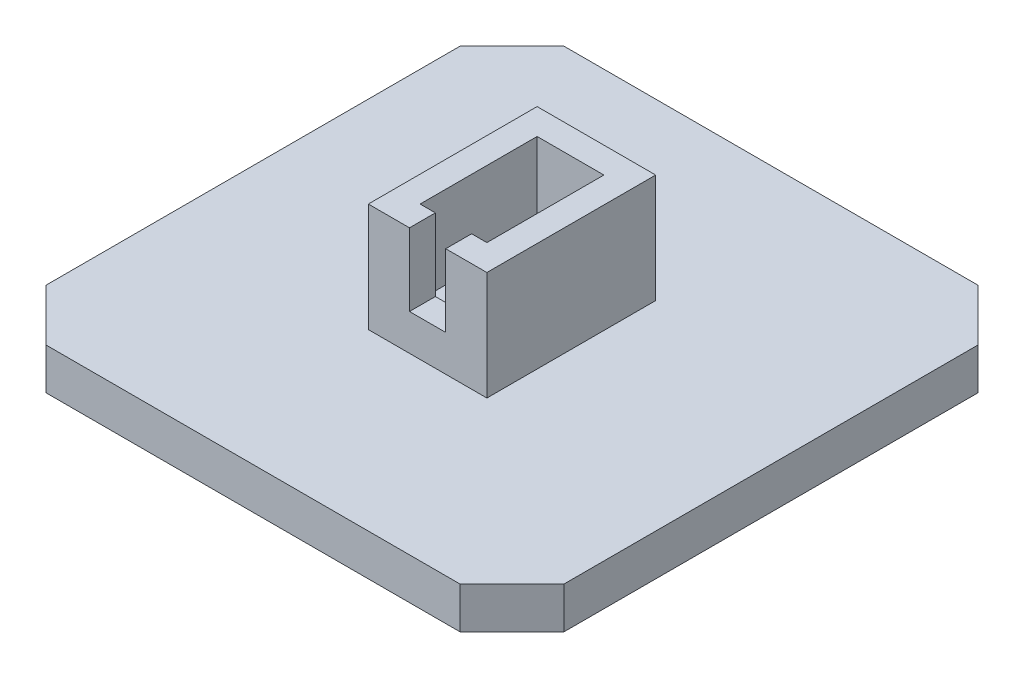
from build123d import *

# Parameters (mm, degrees)
SKETCH1_W               = 22.6
SKETCH1_H               = 16
BASE_BLOCK_DEPTH        = 6.45
SHELL1_T                = 5
CABLE_PASSTHROUGH_REACH = 25.786
SKETCH2_W               = 7
SKETCH2_H               = 14
SKETCH3_W               = 100
SKETCH3_H               = 100
BASE_PLATE_DEPTH        = 8
CORNER_CHAMFER_SIZE     = 10


with BuildPart() as part:
    # Sketch1 → base block (new, symmetric)
    with BuildSketch(Plane(origin=(0, 0, 0), x_dir=(0, 0, -1), z_dir=(1, 0, 0))):
        Rectangle(SKETCH1_W, SKETCH1_H)
    extrude(amount=BASE_BLOCK_DEPTH, both=True)

    # Shell1
    shell1_openings = [part.faces().sort_by_distance(p)[0] for p in [
        (0, 8, 0),
    ]]
    offset(amount=SHELL1_T, openings=shell1_openings, kind=Kind.INTERSECTION)

    # Sketch2 → cable passthrough (cut, up to next)
    with BuildSketch(Plane.XY, mode=Mode.PRIVATE) as cable_passthrough_sk1:
        with Locations((0, 1)):
            Rectangle(SKETCH2_W, SKETCH2_H)
    cable_passthrough_tool1 = extrude(cable_passthrough_sk1.sketch, amount=CABLE_PASSTHROUGH_REACH, mode=Mode.PRIVATE) & part.part
    add(cable_passthrough_tool1.solids().sort_by_distance((0, 1, 0))[0], mode=Mode.SUBTRACT)

    # Sketch3 → base plate (add)
    with BuildSketch(Plane.XZ.offset(13)):
        Rectangle(SKETCH3_W, SKETCH3_H)
    extrude(amount=BASE_PLATE_DEPTH)

    # corner chamfer
    corner_chamfer_edges = [part.edges().sort_by_distance(p)[0] for p in [
        (50, -17, -50),
        (50, -17, 50),
        (-50, -17, 50),
        (-50, -17, -50),
    ]]
    chamfer(corner_chamfer_edges, length=CORNER_CHAMFER_SIZE)


solid = part.part
